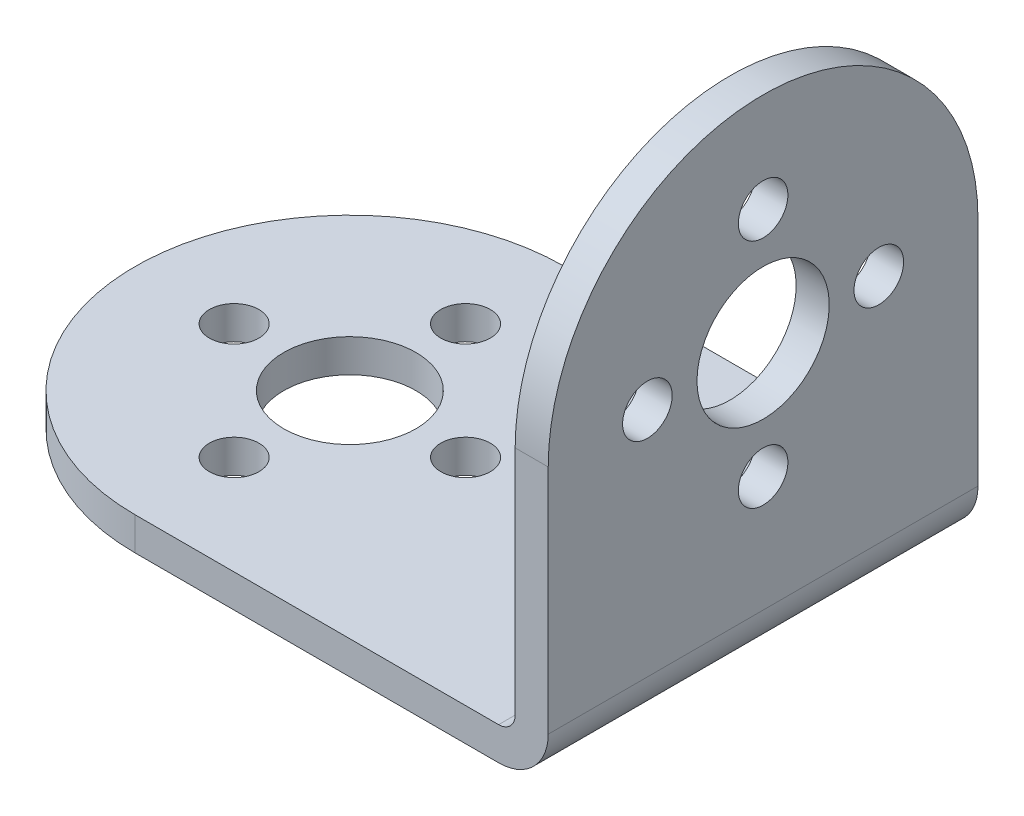
from build123d import *

# Parameters (mm, degrees)
EXTRUDE_1_DEPTH     = 26
FILLET_1_R          = 1
FILLET_2_R          = 3
SKETCH_2_R          = 1.5
SKETCH_2_R_2        = 4
CUT_EXTRUDE_1_DEPTH = 26
SKETCH_3_R          = 1.5
SKETCH_3_R_2        = 4
CUT_EXTRUDE_2_DEPTH = 26


with BuildPart() as part:
    # 草图1 → 凸台-拉伸1 (new body)
    with BuildSketch(Plane.XY):
        Polygon((-19, -15), (19, -15), (19, 15), (17, 15), (17, -13), (-19, -13), align=None)
    extrude(amount=EXTRUDE_1_DEPTH)

    # 圆角1
    fillet_1_edges = [part.edges().sort_by_distance(p)[0] for p in [
        (17, -13, 13),
    ]]
    fillet(fillet_1_edges, radius=FILLET_1_R)

    # 圆角2
    fillet_2_edges = [part.edges().sort_by_distance(p)[0] for p in [
        (19, -15, 13),
    ]]
    fillet(fillet_2_edges, radius=FILLET_2_R)

    # 草图2 → 切除-拉伸1 (cut)
    with BuildSketch(Plane.ZY.offset(-17)):
        with BuildLine():
            Line((26, 15), (13, 15))
            ThreePointArc((13, 15), (22.192388155, 11.192388155), (26, 2))
            Line((26, 2), (26, 15))
        make_face()
        with BuildLine():
            Line((0, 15), (0, 2))
            ThreePointArc((0, 2), (3.807611845, 11.192388155), (13, 15))
            Line((13, 15), (0, 15))
        make_face()
        with Locations((6, 2)):
            Circle(SKETCH_2_R)
        with Locations((13, 9)):
            Circle(SKETCH_2_R)
        with Locations((13, -5)):
            Circle(SKETCH_2_R)
        with Locations((20, 2)):
            Circle(SKETCH_2_R)
        with Locations((13, 2)):
            Circle(SKETCH_2_R_2)
    extrude(amount=-CUT_EXTRUDE_1_DEPTH, mode=Mode.SUBTRACT)

    # 草图3 → 切除-拉伸2 (cut)
    with BuildSketch(Plane(origin=(0, -13, 0), x_dir=(1, 0, 0), z_dir=(0, 1, 0))):
        with BuildLine():
            ThreePointArc((-19, -13), (-15.192388155, -3.807611845), (-6, 0))
            Line((-6, 0), (-19, 0))
            Line((-19, 0), (-19, -13))
        make_face()
        with Locations(Location((-6, -6, 0), (0, 0, 270))):
            Circle(SKETCH_3_R)
        with Locations(Location((-6, -13, 0), (0, 0, 270))):
            Circle(SKETCH_3_R_2)
        with Locations(Location((1, -13, 0), (0, 0, 270))):
            Circle(SKETCH_3_R)
        with Locations(Location((-13, -13, 0), (0, 0, 270))):
            Circle(SKETCH_3_R)
        with Locations(Location((-6, -20, 0), (0, 0, 270))):
            Circle(SKETCH_3_R)
        with BuildLine():
            ThreePointArc((-6, -26), (-15.192388155, -22.192388155), (-19, -13))
            Line((-19, -13), (-19, -26))
            Line((-19, -26), (-6, -26))
        make_face()
    extrude(amount=-CUT_EXTRUDE_2_DEPTH, mode=Mode.SUBTRACT)


solid = part.part
